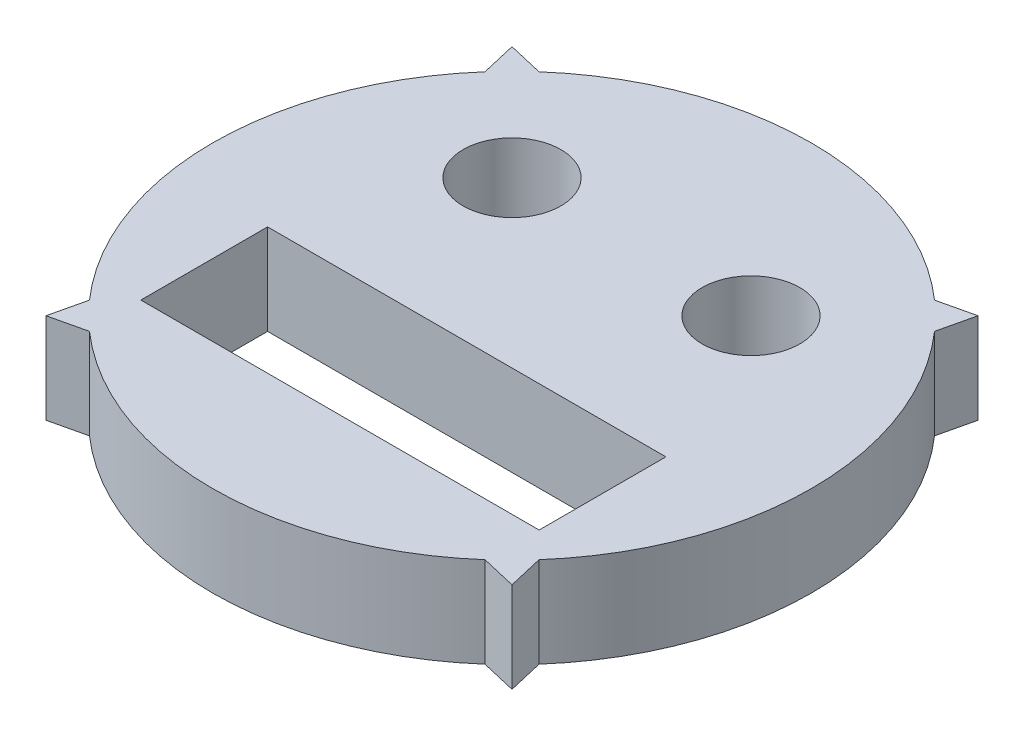
from build123d import *

# Parameters (mm, degrees)
SKETCH1_R           = 3.429
SKETCH1_W           = 27.94
SKETCH1_H           = 8.89
BOSS_EXTRUDE1_DEPTH = 6.35


with BuildPart() as part:
    # Sketch1 → Boss-Extrude1 (new body)
    with BuildSketch(Plane(origin=(0, 0, 0), x_dir=(1, 0, 0), z_dir=(0, 1, 0))):
        with BuildLine():
            Line((13.870085237, 15.767711804), (16.343875029, 16.343875029))
            Line((16.343875029, 16.343875029), (15.767711804, 13.870085237))
            ThreePointArc((15.767711804, 13.870085237), (21, 0), (15.767711804, -13.870085237))
            Line((15.767711804, -13.870085237), (16.343875029, -16.343875029))
            Line((16.343875029, -16.343875029), (13.870085237, -15.767711804))
            ThreePointArc((13.870085237, -15.767711804), (0, -21), (-13.870085237, -15.767711804))
            Line((-13.870085237, -15.767711804), (-16.343875029, -16.343875029))
            Line((-16.343875029, -16.343875029), (-15.767711804, -13.870085237))
            ThreePointArc((-15.767711804, -13.870085237), (-21, 0), (-15.767711804, 13.870085237))
            Line((-15.767711804, 13.870085237), (-16.343875029, 16.343875029))
            Line((-16.343875029, 16.343875029), (-13.870085237, 15.767711804))
            ThreePointArc((-13.870085237, 15.767711804), (0, 21), (13.870085237, 15.767711804))
        make_face()
        with Locations(Location((-8.382, 8.382, 0), (0, 0, 270))):
            Circle(SKETCH1_R, mode=Mode.SUBTRACT)
        with Locations(Location((8.382, 8.382, 0), (0, 0, 270))):
            Circle(SKETCH1_R, mode=Mode.SUBTRACT)
        with Locations((0, -7.62)):
            Rectangle(SKETCH1_W, SKETCH1_H, mode=Mode.SUBTRACT)
    extrude(amount=BOSS_EXTRUDE1_DEPTH)


solid = part.part
